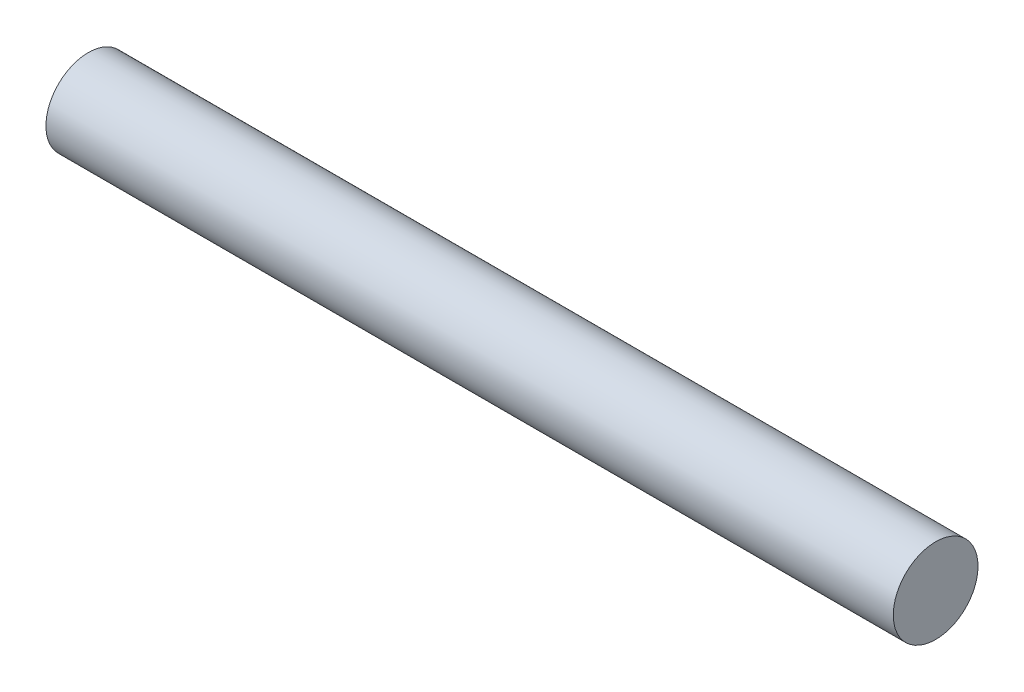
from build123d import *

# Parameters (mm, degrees)
SKETCH2_R           = 6.35
BOSS_EXTRUDE1_DEPTH = 127


with BuildPart() as part:
    # Sketch2 → Boss-Extrude1 (new body)
    with BuildSketch(Plane(origin=(0, 0, 0), x_dir=(0, 0, -1), z_dir=(1, 0, 0))):
        Circle(SKETCH2_R)
    extrude(amount=BOSS_EXTRUDE1_DEPTH)


solid = part.part
